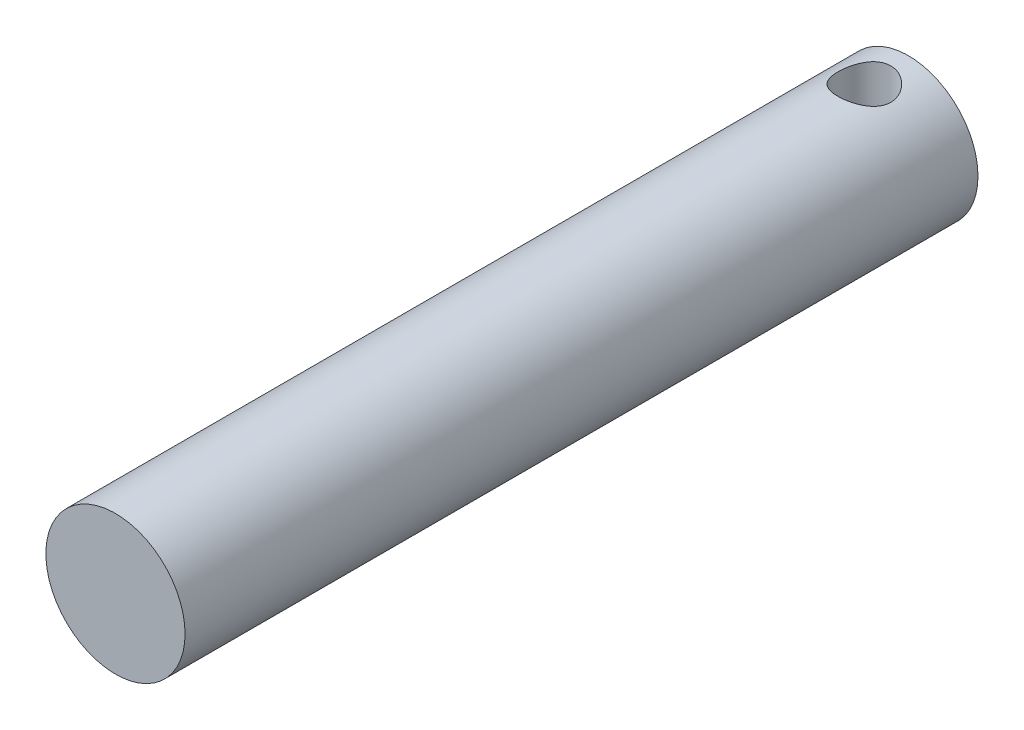
from build123d import *

# Parameters (mm, degrees)
SKETCH1_R               = 3.95
BOSS_EXTRUDE1_DEPTH     = 45
CUT_EXTRUDE1_DEPTH      = 46.345396679
CUT_EXTRUDE1_DEPTH_BACK = 46.345396679
SKETCH2_R               = 1.5


with BuildPart() as part:
    # Sketch1 → Boss-Extrude1 (new body)
    with BuildSketch(Plane.XY):
        Circle(SKETCH1_R)
    extrude(amount=BOSS_EXTRUDE1_DEPTH)

    # Sketch2 → Cut-Extrude1 (cut, two sides: drawn at the far end of the back side and taken through both)
    with BuildSketch(Plane(origin=(0, 0, 0), x_dir=(1, 0, 0), z_dir=(0, 1, 0)).offset(-CUT_EXTRUDE1_DEPTH_BACK)):
        with Locations(Location((0, -2.5, 0), (0, 0, 270))):
            Circle(SKETCH2_R)
    extrude(amount=CUT_EXTRUDE1_DEPTH + CUT_EXTRUDE1_DEPTH_BACK, mode=Mode.SUBTRACT)


solid = part.part
